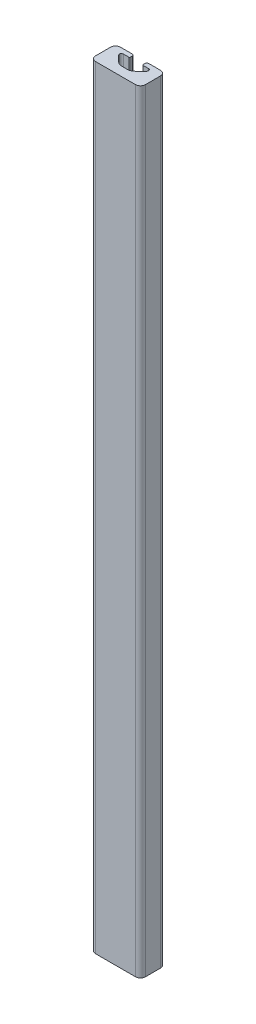
from build123d import *

# Parameters (mm, degrees)
SALIENTE_EXTRUIR1_DEPTH = 310


with BuildPart() as part:
    # Croquis1 → Saliente-Extruir1 (new body)
    with BuildSketch(Plane(origin=(0, 0, 0), x_dir=(1, 0, 0), z_dir=(0, 1, 0))):
        with BuildLine():
            Line((4.625, 10), (0, 10))
            ThreePointArc((0, 10), (-1.414213562, 9.414213562), (-2, 8))
            Line((-2, 8), (-2, 2))
            ThreePointArc((-2, 2), (-1.414213562, 0.585786438), (0, 0))
            Line((0, 0), (16, 0))
            ThreePointArc((16, 0), (17.414213562, 0.585786438), (18, 2))
            Line((18, 2), (18, 8))
            ThreePointArc((18, 8), (17.41421361, 9.41421365), (16, 10.000000135))
            Line((16, 10.000000135), (11.374999664, 10.000000135))
            ThreePointArc((11.374999664, 10.000000135), (10.809314239, 9.76568556), (10.574999664, 9.200000135))
            Line((10.574999664, 9.200000135), (10.574999664, 8.500000898))
            ThreePointArc((10.574999664, 8.500000898), (10.662867611, 8.287868883), (10.87499961, 8.200000898))
            Line((10.87499961, 8.200000898), (13.044121001, 8.200000507))
            ThreePointArc((13.044121001, 8.200000507), (13.764747104, 7.718493399), (13.595664288, 6.868456885))
            Line((13.595664288, 6.868456885), (11.255887257, 4.528679854))
            ThreePointArc((11.255887257, 4.528679854), (10.282617211, 3.8783616), (9.134566914, 3.650000197))
            Line((9.134566914, 3.650000197), (6.865432698, 3.650000197))
            ThreePointArc((6.865432698, 3.650000197), (5.7173824, 3.878361599), (4.744112353, 4.528679854))
            Line((4.744112353, 4.528679854), (2.404335323, 6.868456883))
            ThreePointArc((2.404335323, 6.868456883), (2.23525255, 7.718493184), (2.955878471, 8.200000172))
            Line((2.955878471, 8.200000172), (5.124999858, 8.200000566))
            ThreePointArc((5.124999858, 8.200000566), (5.337131996, 8.287868609), (5.425, 8.500000763))
            Line((5.425, 8.500000763), (5.425, 9.2))
            ThreePointArc((5.425, 9.2), (5.190685425, 9.765685425), (4.625, 10))
        make_face()
    extrude(amount=SALIENTE_EXTRUIR1_DEPTH)


solid = part.part
